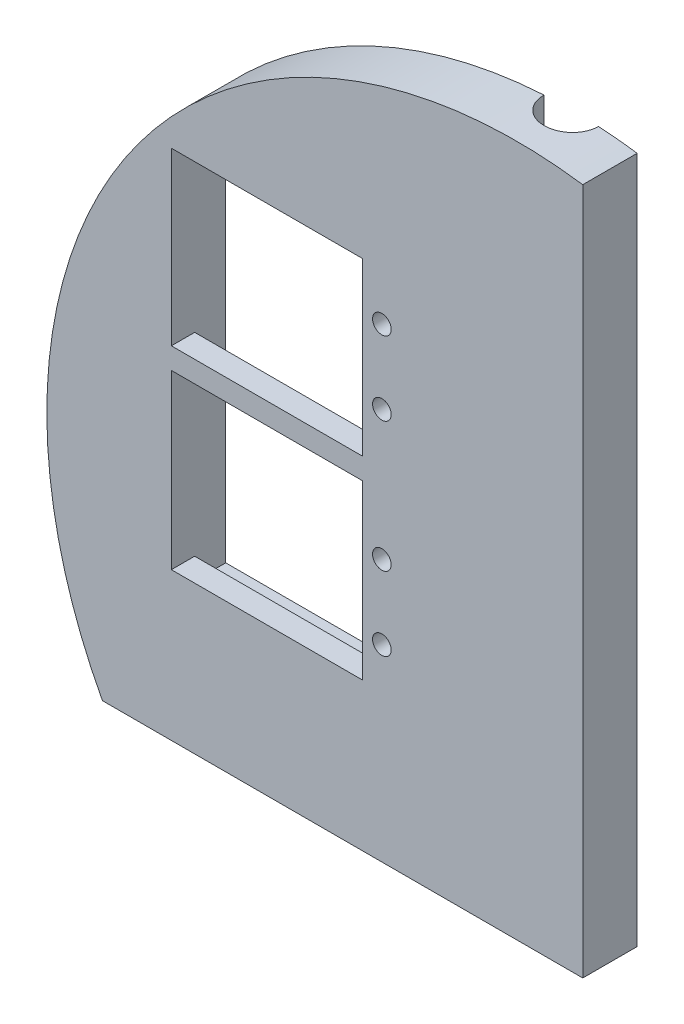
from build123d import *

# Parameters (mm, degrees)
SKETCH1_R                                       = 60.5
BOSS_EXTRUDE1_DEPTH                             = 7
SKETCH6_R                                       = 3.5
CUT_EXTRUDE2_DEPTH                              = 70
CUT_EXTRUDE7_DEPTH                              = 10
SKETCH23_W                                      = 42.472377856
SKETCH23_H                                      = 49.728625228
CUT_EXTRUDE8_DEPTH                              = 4
SKETCH24_W                                      = 49.728625228
SKETCH24_H                                      = 1.127718677
CUT_EXTRUDE10_DEPTH                             = 1
CSK_FOR_M2_FLAT_HEAD_MACHINE_SCREW1_D           = 2.4
CSK_FOR_M2_FLAT_HEAD_MACHINE_SCREW1_CSINK_D     = 4.4
CSK_FOR_M2_FLAT_HEAD_MACHINE_SCREW1_CSINK_ANGLE = 90
SKETCH30_W                                      = 24.590301857
SKETCH30_H                                      = 22.033921334
CUT_EXTRUDE11_DEPTH                             = 10
SKETCH39_R                                      = 2.5
CUT_EXTRUDE14_DEPTH                             = 13
SKETCH42_R                                      = 3.1
CUT_EXTRUDE15_DEPTH                             = 1
SKETCH43_W                                      = 2.738349456
SKETCH43_H                                      = 1.372281323
CUT_EXTRUDE17_DEPTH                             = 1


with BuildPart() as part:
    # Sketch1 → Boss-Extrude1 (new body)
    with BuildSketch(Plane(origin=(0, 0, 0), x_dir=(0, 1, 0), z_dir=(0, 0, 1))):
        with Locations(Location((0, 0, 0), (0, 0, 270))):
            Circle(SKETCH1_R)
    extrude(amount=BOSS_EXTRUDE1_DEPTH)

    # Sketch6 → Cut-Extrude2 (cut)
    with BuildSketch(Plane(origin=(0, 60.5, -6), x_dir=(-1, 0, 0), z_dir=(0, 1, 0))):
        with Locations((0, 6)):
            Circle(SKETCH6_R)
    extrude(amount=-CUT_EXTRUDE2_DEPTH, mode=Mode.SUBTRACT)

    # Sketch21 → Cut-Extrude7 (cut)
    with BuildSketch(Plane.XY.offset(7)):
        with BuildLine():
            Line((8.487846034, 59.901639958), (8.487846034, -28.542105861))
            Line((8.487846034, -28.542105861), (-53.344148629, -28.542105861))
            ThreePointArc((-53.344148629, -28.542105861), (113.000185213, -78.999671309), (8.487846034, 59.901639958))
        make_face()
    extrude(amount=-CUT_EXTRUDE7_DEPTH, mode=Mode.SUBTRACT)

    # Sketch23 → Cut-Extrude8 (cut)
    with BuildSketch(Plane(origin=(0, 0, 0), x_dir=(1, 0, 0), z_dir=(0, 0, -1))):
        with Locations((-23.236188928, -12.625963158)):
            Rectangle(SKETCH23_W, SKETCH23_H)
    extrude(amount=-CUT_EXTRUDE8_DEPTH, mode=Mode.SUBTRACT)

    # Sketch24 → Cut-Extrude10 (cut)
    with BuildSketch(Plane(origin=(-2, 0, 0), x_dir=(0, -1, 0), z_dir=(-1, 0, 0))):
        with Locations((-12.625963158, 3.436140662)):
            Rectangle(SKETCH24_W, SKETCH24_H)
    extrude(amount=-CUT_EXTRUDE10_DEPTH, mode=Mode.SUBTRACT)

    # CSK for M2 Flat Head Machine Screw1 (through all)
    with Locations(Plane.YX.offset(-4)):
        with Locations((-4.307531, -17.373644116), (5.192468135, -17.377696999), (21.926905074, -17.371512218), (31.426905074, -17.371512218)):
            CounterSinkHole(CSK_FOR_M2_FLAT_HEAD_MACHINE_SCREW1_D / 2, CSK_FOR_M2_FLAT_HEAD_MACHINE_SCREW1_CSINK_D / 2, counter_sink_angle=CSK_FOR_M2_FLAT_HEAD_MACHINE_SCREW1_CSINK_ANGLE)

    # Sketch30 → Cut-Extrude11 (cut)
    with BuildSketch(Plane(origin=(0, 0, 4), x_dir=(1, 0, 0), z_dir=(0, 0, -1))):
        with Locations((-32.177226928, -26.473315105)):
            Rectangle(SKETCH30_W, SKETCH30_H)
        Polygon((-19.882075999, -12.713705866), (-44.472377856, -12.713705866), (-44.472377856, 9.50080752), (-19.871510792, 9.50080752), align=None)
    extrude(amount=-CUT_EXTRUDE11_DEPTH, mode=Mode.SUBTRACT)

    # Sketch39 → Cut-Extrude14 (cut)
    with BuildSketch(Plane(origin=(0, -9.5, 0), x_dir=(-1, 0, 0), z_dir=(0, 1, 0))):
        Circle(SKETCH39_R)
    extrude(amount=-CUT_EXTRUDE14_DEPTH, mode=Mode.SUBTRACT)

    # Sketch42 → Cut-Extrude15 (cut, symmetric)
    with BuildSketch(Plane(origin=(0, -15.738349456, 0), x_dir=(-1, 0, 0), z_dir=(0, 1, 0))):
        Circle(SKETCH42_R)
    extrude(amount=CUT_EXTRUDE15_DEPTH, both=True, mode=Mode.SUBTRACT)

    # Sketch43 → Cut-Extrude17 (cut)
    with BuildSketch(Plane(origin=(-2, 0, 0), x_dir=(0, -1, 0), z_dir=(-1, 0, 0))):
        with Locations((10.869174728, 2.186140662)):
            Rectangle(SKETCH43_W, SKETCH43_H)
    extrude(amount=-CUT_EXTRUDE17_DEPTH, mode=Mode.SUBTRACT)


solid = part.part
